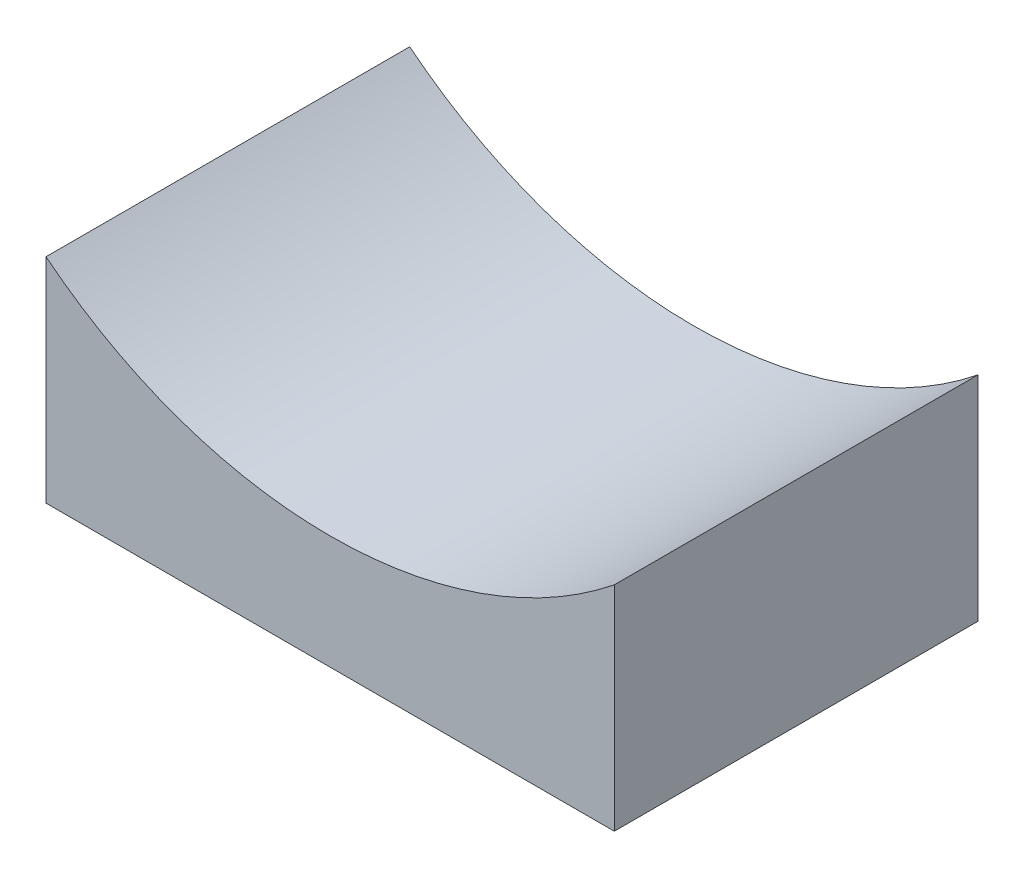
from build123d import *

# Parameters (mm, degrees)
SKETCH1_W           = 100
SKETCH1_H           = 64
BOSS_EXTRUDE1_DEPTH = 80
CUT_EXTRUDE1_DEPTH  = 144.164241345


with BuildPart() as part:
    # Sketch1 → Boss-Extrude1 (new body)
    with BuildSketch(Plane(origin=(0, 0, 0), x_dir=(1, 0, 0), z_dir=(0, 1, 0))):
        with Locations((50, 32)):
            Rectangle(SKETCH1_W, SKETCH1_H)
    extrude(amount=BOSS_EXTRUDE1_DEPTH)

    # Sketch2 → Cut-Extrude1 (cut, through all)
    with BuildSketch(Plane.XY):
        with BuildLine():
            Line((-30, 100), (130, 100))
            ThreePointArc((130, 100), (50, 20), (-30, 100))
        make_face()
    extrude(amount=-CUT_EXTRUDE1_DEPTH, mode=Mode.SUBTRACT)


solid = part.part
